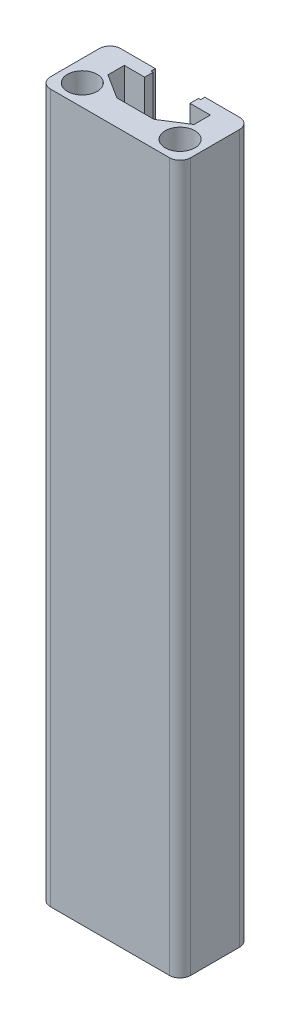
from build123d import *

# Parameters (mm, degrees)
SKETCH_1_R      = 2.1
EXTRUDE_1_DEPTH = 100


with BuildPart() as part:
    # 草图1 → 凸台-拉伸1 (new body)
    with BuildSketch(Plane(origin=(0, 0, 0), x_dir=(1, 0, 0), z_dir=(0, 1, 0))):
        with BuildLine():
            Line((8.4, 0), (-8.4, 0))
            ThreePointArc((-8.4, 0), (-9.460660172, 0.439339828), (-9.9, 1.5))
            Line((-9.9, 1.5), (-9.9, 8.4))
            ThreePointArc((-9.9, 8.4), (-9.460660172, 9.460660172), (-8.4, 9.9))
            Line((-8.4, 9.9), (-3.5, 9.9))
            Line((-3.5, 9.9), (-3.5, 9.288498403))
            Line((-3.5, 9.288498403), (-3.2, 9.288498403))
            Line((-3.2, 9.288498403), (-3.2, 8.1))
            Line((-3.2, 8.1), (-6.074788311, 8.1))
            Line((-6.074788311, 8.1), (-6.074788311, 5.792971246))
            Line((-6.074788311, 5.792971246), (-2.616641346, 3.6))
            Line((-2.616641346, 3.6), (2.616641346, 3.6))
            Line((2.616641346, 3.6), (6.074788311, 5.792971246))
            Line((6.074788311, 5.792971246), (6.074788311, 8.1))
            Line((6.074788311, 8.1), (3.2, 8.1))
            Line((3.2, 8.1), (3.2, 9.288498403))
            Line((3.2, 9.288498403), (3.5, 9.288498403))
            Line((3.5, 9.288498403), (3.5, 9.9))
            Line((3.5, 9.9), (8.4, 9.9))
            ThreePointArc((8.4, 9.9), (9.460660172, 9.460660172), (9.9, 8.4))
            Line((9.9, 8.4), (9.9, 1.5))
            ThreePointArc((9.9, 1.5), (9.460660172, 0.439339828), (8.4, 0))
        make_face()
        with Locations(Location((-6.9, 3, 0), (0, 0, 270))):
            Circle(SKETCH_1_R, mode=Mode.SUBTRACT)
        with Locations(Location((6.9, 3, 0), (0, 0, 90))):
            Circle(SKETCH_1_R, mode=Mode.SUBTRACT)
    extrude(amount=EXTRUDE_1_DEPTH)


solid = part.part
